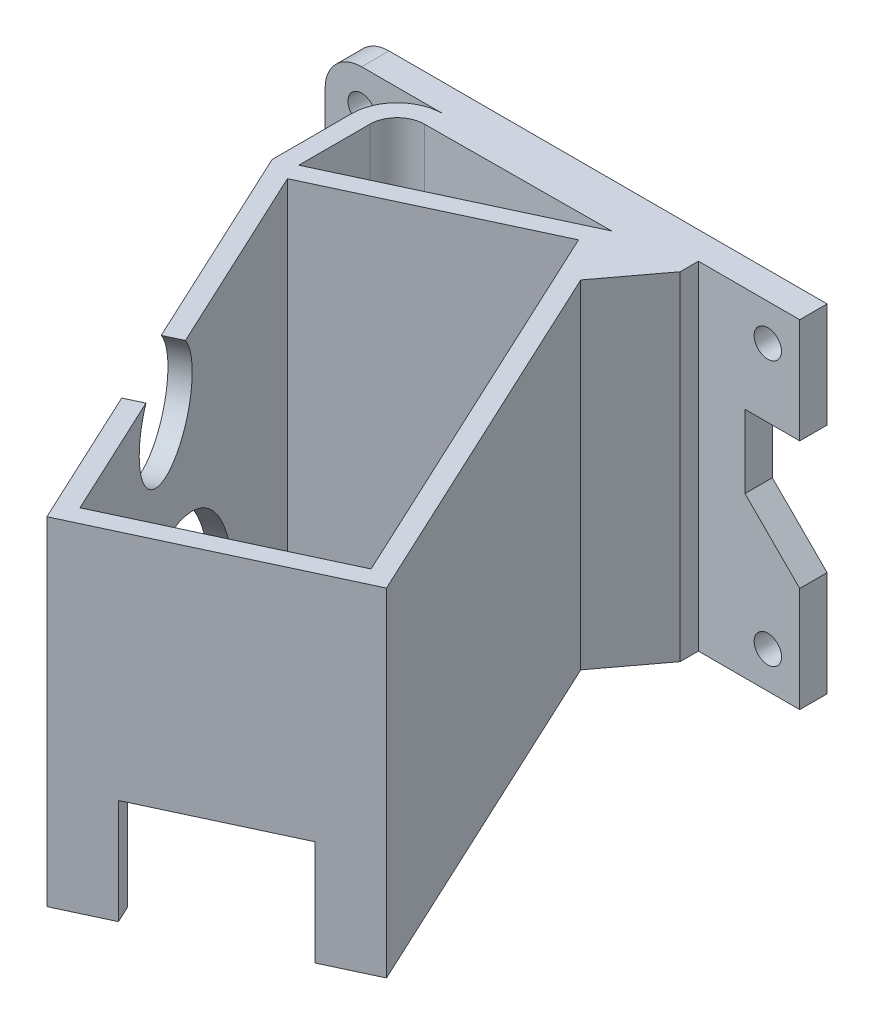
from build123d import *

# Parameters (mm, degrees)
CROQUIS1_R              = 1.5
SALIENTE_EXTRUIR1_DEPTH = 3
SALIENTE_EXTRUIR2_DEPTH = 37
CROQUIS4_R              = 15.5
CROQUIS4_R_2            = 6
CORTAR_EXTRUIR1_DEPTH   = 2
CORTAR_EXTRUIR2_DEPTH   = 2


with BuildPart() as part:
    # Croquis1 → Saliente-Extruir1 (new body)
    with BuildSketch(Plane.XY):
        with BuildLine():
            Line((-49.197309417, 11.961883408), (-56.197309417, 4.961883408))
            Line((-56.197309417, 4.961883408), (-56.197309417, 0.461883408))
            ThreePointArc((-56.197309417, 0.461883408), (-55.099110766, -2.293519818), (-52.406664651, -3.538116592))
            Line((-52.406664651, -3.538116592), (-4.197309417, -3.538116592))
            Line((-4.197309417, -3.538116592), (-4.197309417, 7.961883408))
            Line((-4.197309417, 7.961883408), (-10.197309417, 13.961883408))
            Line((-10.197309417, 13.961883408), (-10.197309417, 21.961883408))
            Line((-10.197309417, 21.961883408), (-4.197309417, 21.961883408))
            Line((-4.197309417, 21.961883408), (-4.197309417, 33.461883408))
            Line((-4.197309417, 33.461883408), (-52.197309417, 33.461883408))
            ThreePointArc((-52.197309417, 33.461883408), (-55.025736542, 32.290310533), (-56.197309417, 29.461883408))
            Line((-56.197309417, 29.461883408), (-56.197309417, 24.961883408))
            Line((-56.197309417, 24.961883408), (-49.197309417, 24.961883408))
            Line((-49.197309417, 24.961883408), (-49.197309417, 11.961883408))
        make_face()
        with Locations((-52.19152813, 0.461883408)):
            Circle(CROQUIS1_R, mode=Mode.SUBTRACT)
        with Locations((-7.69152813, 0.461883408)):
            Circle(CROQUIS1_R, mode=Mode.SUBTRACT)
        with Locations((-52.197309417, 29.461883408)):
            Circle(CROQUIS1_R, mode=Mode.SUBTRACT)
        with Locations((-7.697309417, 29.461882832)):
            Circle(CROQUIS1_R, mode=Mode.SUBTRACT)
    extrude(amount=SALIENTE_EXTRUIR1_DEPTH)

    # Croquis3 → Saliente-Extruir2 (add)
    with BuildSketch(Plane.XZ.offset(3.538116592)):
        with BuildLine():
            Line((-28.301987034, 3), (-15.301987034, 3))
            Line((-15.301987034, 3), (-15.301987034, 5))
            Line((-15.301987034, 5), (-19.967041165, 11.226302412))
            Line((-19.967041165, 11.226302412), (-1.371837648, 51.103845041))
            Line((-1.371837648, 51.103845041), (-26.748455685, 62.93715637))
            Line((-26.748455685, 62.93715637), (-48.301987034, 16.715459231))
            Line((-48.301987034, 16.715459231), (-48.301987034, 8))
            ThreePointArc((-48.301987034, 8), (-46.83752094, 4.464466094), (-43.301987034, 3))
            Line((-43.301987034, 3), (-28.301987034, 3))
        make_face()
        Polygon((-45.644134936, 17.682838282), (-25.781076635, 60.279304272), (-4.029689746, 50.136465991), (-23.892748048, 7.54), align=None, mode=Mode.SUBTRACT)
        with BuildLine():
            Line((-43.301987034, 5), (-22.925368997, 4.882147902))
            Line((-22.925368997, 4.882147902), (-46.301987034, 15.782843915))
            Line((-46.301987034, 15.782843915), (-46.301987034, 8))
            ThreePointArc((-46.301987034, 8), (-45.423307378, 5.878679656), (-43.301987034, 5))
        make_face(mode=Mode.SUBTRACT)
    extrude(amount=-SALIENTE_EXTRUIR2_DEPTH)

    # Croquis4 → Cortar-Extruir1 (cut)
    with BuildSketch(Plane(origin=(-46.07734524, 0, 21.486218953), x_dir=(0.42261826174069334, 0, 0.9063077870366529), z_dir=(-0.9063077870366529, 0, 0.42261826174069334))):
        with Locations((24.316351755, 1.961883408)):
            Circle(CROQUIS4_R)
        with Locations((24.316351755, 29.461883408)):
            Circle(CROQUIS4_R_2)
    extrude(amount=-CORTAR_EXTRUIR1_DEPTH, mode=Mode.SUBTRACT)

    # Croquis5 → Cortar-Extruir2 (cut)
    with BuildSketch(Plane(origin=(19.328889555, 0, 41.450937417), x_dir=(0.9063077870366526, 0, -0.42261826174069395), z_dir=(0.42261826174069395, 0, 0.9063077870366526))):
        Polygon((-36.840725303, -3.538116592), (-44.940725303, -3.538116592), (-44.940725303, 7.961883408), (-28.740725303, 7.961883408), (-28.740725303, -3.538116592), align=None)
    extrude(amount=-CORTAR_EXTRUIR2_DEPTH, mode=Mode.SUBTRACT)


solid = part.part
